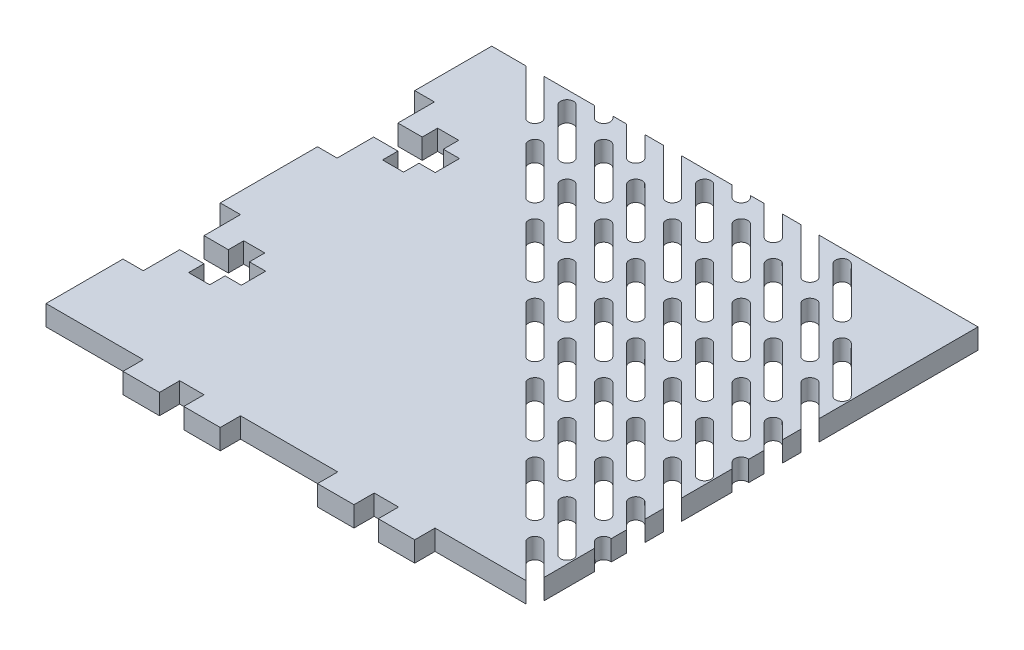
from build123d import *

# Parameters (mm, degrees)
BOSS_EXTRUDE1_DEPTH = 3.175
CUT_EXTRUDE1_DEPTH  = 54.975


with BuildPart() as part:
    # Sketch1 → Boss-Extrude1 (new body)
    with BuildSketch(Plane(origin=(0, 0, 0), x_dir=(1, 0, 0), z_dir=(0, 1, 0))):
        Polygon((-27.813, -13.335), (-25.273, -13.335), (-25.273, -17.145), (-27.813, -17.145), (-27.813, -19.558), (-31.115, -19.558), (-31.115, -17.145), (-34.925, -17.145), (-34.925, -22.86), (-38.1, -22.86), (-38.1, -34.925), (-34.925, -34.925), (-22.86, -34.925), (-22.86, -38.1), (-17.145, -38.1), (-17.145, -34.925), (-13.335, -34.925), (-13.335, -38.1), (-7.62, -38.1), (-7.62, -34.925), (7.62, -34.925), (7.62, -38.1), (13.335, -38.1), (13.335, -34.925), (17.145, -34.925), (17.145, -38.1), (22.86, -38.1), (22.86, -34.925), (34.925, -34.925), (38.1, -34.925), (38.1, -22.86), (38.1, 34.925), (34.925, 34.925), (22.86, 34.925), (-34.925, 34.925), (-38.1, 34.925), (-38.1, 22.86), (-35.021495431, 22.86), (-35.021495431, 17.145), (-31.211495431, 17.145), (-31.211495431, 19.558), (-27.909495431, 19.558), (-27.909495431, 17.145), (-25.369495431, 17.145), (-25.369495431, 13.335), (-27.909495431, 13.335), (-27.909495431, 10.922), (-31.211495431, 10.922), (-31.211495431, 13.335), (-35.021495431, 13.335), (-35.021495431, 7.62), (-38.1, 7.62), (-38.1, -7.62), (-34.925, -7.62), (-34.925, -13.335), (-31.115, -13.335), (-31.115, -10.922), (-27.813, -10.922), align=None)
    extrude(amount=BOSS_EXTRUDE1_DEPTH)

    # Sketch2 → Cut-Extrude1 (cut, through all)
    with BuildSketch(Plane.XZ):
        with BuildLine():
            Line((-32.837932463, -34.993193932), (-25.653727566, -27.808989035))
            ThreePointArc((-25.653727566, -27.808989035), (-24.216886587, -27.808989035), (-24.216886587, -29.245830015))
            Line((-24.216886587, -29.245830015), (-31.401091484, -36.430034912))
            ThreePointArc((-31.401091484, -36.430034912), (-32.837932463, -36.430034912), (-32.837932463, -34.993193932))
        make_face()
        with BuildLine():
            Line((-24.935307077, -32.119511973), (-17.75110218, -24.935307077))
            ThreePointArc((-17.75110218, -24.935307077), (-16.3142612, -24.935307077), (-16.3142612, -26.372148056))
            Line((-16.3142612, -26.372148056), (-23.498466097, -33.556352953))
            ThreePointArc((-23.498466097, -33.556352953), (-24.935307077, -33.556352953), (-24.935307077, -32.119511973))
        make_face()
        with BuildLine():
            Line((-22.061625118, -24.216886587), (-14.877420221, -17.03268169))
            ThreePointArc((-14.877420221, -17.03268169), (-13.440579242, -17.03268169), (-13.440579242, -18.469522669))
            Line((-13.440579242, -18.469522669), (-20.624784138, -25.653727566))
            ThreePointArc((-20.624784138, -25.653727566), (-22.061625118, -25.653727566), (-22.061625118, -24.216886587))
        make_face()
        with BuildLine():
            Line((-14.158999731, -21.343204628), (-6.974794834, -14.158999731))
            ThreePointArc((-6.974794834, -14.158999731), (-5.537953855, -14.158999731), (-5.537953855, -15.595840711))
            Line((-5.537953855, -15.595840711), (-12.722158752, -22.780045608))
            ThreePointArc((-12.722158752, -22.780045608), (-14.158999731, -22.780045608), (-14.158999731, -21.343204628))
        make_face()
        with BuildLine():
            Line((-11.285317773, -13.440579242), (-4.101112876, -6.256374345))
            ThreePointArc((-4.101112876, -6.256374345), (-2.664271896, -6.256374345), (-2.664271896, -7.693215324))
            Line((-2.664271896, -7.693215324), (-9.848476793, -14.877420221))
            ThreePointArc((-9.848476793, -14.877420221), (-11.285317773, -14.877420221), (-11.285317773, -13.440579242))
        make_face()
        with BuildLine():
            Line((-3.382692386, -10.566897283), (3.801512511, -3.382692386))
            ThreePointArc((3.801512511, -3.382692386), (5.23835349, -3.382692386), (5.23835349, -4.819533365))
            Line((5.23835349, -4.819533365), (-1.945851407, -12.003738262))
            ThreePointArc((-1.945851407, -12.003738262), (-3.382692386, -12.003738262), (-3.382692386, -10.566897283))
        make_face()
        with BuildLine():
            Line((-0.509010427, -2.664271896), (6.67519447, 4.519933001))
            ThreePointArc((6.67519447, 4.519933001), (8.112035449, 4.519933001), (8.112035449, 3.083092021))
            Line((8.112035449, 3.083092021), (0.927830552, -4.101112876))
            ThreePointArc((0.927830552, -4.101112876), (-0.509010427, -4.101112876), (-0.509010427, -2.664271896))
        make_face()
        with BuildLine():
            Line((7.393614959, 0.209410062), (14.577819856, 7.393614959))
            ThreePointArc((14.577819856, 7.393614959), (16.014660835, 7.393614959), (16.014660835, 5.95677398))
            Line((16.014660835, 5.95677398), (8.830455939, -1.227430917))
            ThreePointArc((8.830455939, -1.227430917), (7.393614959, -1.227430917), (7.393614959, 0.209410062))
        make_face()
        with BuildLine():
            Line((10.267296918, 8.112035449), (17.451501815, 15.296240346))
            ThreePointArc((17.451501815, 15.296240346), (18.888342794, 15.296240346), (18.888342794, 13.859399366))
            Line((18.888342794, 13.859399366), (11.704137897, 6.67519447))
            ThreePointArc((11.704137897, 6.67519447), (10.267296918, 6.67519447), (10.267296918, 8.112035449))
        make_face()
        with BuildLine():
            Line((18.169922305, 10.985717408), (25.354127201, 18.169922305))
            ThreePointArc((25.354127201, 18.169922305), (26.790968181, 18.169922305), (26.790968181, 16.733081325))
            Line((26.790968181, 16.733081325), (19.606763284, 9.548876428))
            ThreePointArc((19.606763284, 9.548876428), (18.169922305, 9.548876428), (18.169922305, 10.985717408))
        make_face()
        with BuildLine():
            Line((21.043604263, 18.888342794), (28.22780916, 26.072547691))
            ThreePointArc((28.22780916, 26.072547691), (29.66465014, 26.072547691), (29.66465014, 24.635706712))
            Line((29.66465014, 24.635706712), (22.480445243, 17.451501815))
            ThreePointArc((22.480445243, 17.451501815), (21.043604263, 17.451501815), (21.043604263, 18.888342794))
        make_face()
        with BuildLine():
            Line((28.94622965, 21.762024753), (36.130434547, 28.94622965))
            ThreePointArc((36.130434547, 28.94622965), (37.567275526, 28.94622965), (37.567275526, 27.50938867))
            Line((37.567275526, 27.50938867), (30.383070629, 20.325183774))
            ThreePointArc((30.383070629, 20.325183774), (28.94622965, 20.325183774), (28.94622965, 21.762024753))
        make_face()
        with BuildLine():
            Line((-16.673471445, -29.60504026), (-9.489266548, -22.420835363))
            ThreePointArc((-9.489266548, -22.420835363), (-8.052425569, -22.420835363), (-8.052425569, -23.857676342))
            Line((-8.052425569, -23.857676342), (-15.236630466, -31.041881239))
            ThreePointArc((-15.236630466, -31.041881239), (-16.673471445, -31.041881239), (-16.673471445, -29.60504026))
        make_face()
        with BuildLine():
            Line((-8.770846059, -26.731358301), (-1.586641162, -19.547153404))
            ThreePointArc((-1.586641162, -19.547153404), (-0.149800182, -19.547153404), (-0.149800182, -20.983994383))
            Line((-0.149800182, -20.983994383), (-7.334005079, -28.16819928))
            ThreePointArc((-7.334005079, -28.16819928), (-8.770846059, -28.16819928), (-8.770846059, -26.731358301))
        make_face()
        with BuildLine():
            Line((-5.8971641, -18.828732914), (1.287040797, -11.644528017))
            ThreePointArc((1.287040797, -11.644528017), (2.723881776, -11.644528017), (2.723881776, -13.081368997))
            Line((2.723881776, -13.081368997), (-4.460323121, -20.265573894))
            ThreePointArc((-4.460323121, -20.265573894), (-5.8971641, -20.265573894), (-5.8971641, -18.828732914))
        make_face()
        with BuildLine():
            Line((2.005461287, -15.955050956), (9.189666183, -8.770846059))
            ThreePointArc((9.189666183, -8.770846059), (10.626507163, -8.770846059), (10.626507163, -10.207687038))
            Line((10.626507163, -10.207687038), (3.442302266, -17.391891935))
            ThreePointArc((3.442302266, -17.391891935), (2.005461287, -17.391891935), (2.005461287, -15.955050956))
        make_face()
        with BuildLine():
            Line((4.879143245, -8.052425569), (12.063348142, -0.868220672))
            ThreePointArc((12.063348142, -0.868220672), (13.500189122, -0.868220672), (13.500189122, -2.305061651))
            Line((13.500189122, -2.305061651), (6.315984225, -9.489266548))
            ThreePointArc((6.315984225, -9.489266548), (4.879143245, -9.489266548), (4.879143245, -8.052425569))
        make_face()
        with BuildLine():
            Line((12.781768632, -5.17874361), (19.965973529, 2.005461287))
            ThreePointArc((19.965973529, 2.005461287), (21.402814508, 2.005461287), (21.402814508, 0.568620307))
            Line((21.402814508, 0.568620307), (14.218609611, -6.61558459))
            ThreePointArc((14.218609611, -6.61558459), (12.781768632, -6.61558459), (12.781768632, -5.17874361))
        make_face()
        with BuildLine():
            Line((15.655450591, 2.723881776), (22.839655488, 9.908086673))
            ThreePointArc((22.839655488, 9.908086673), (24.276496467, 9.908086673), (24.276496467, 8.471245694))
            Line((24.276496467, 8.471245694), (17.09229157, 1.287040797))
            ThreePointArc((17.09229157, 1.287040797), (15.655450591, 1.287040797), (15.655450591, 2.723881776))
        make_face()
        with BuildLine():
            Line((23.558075977, 5.597563735), (30.742280874, 12.781768632))
            ThreePointArc((30.742280874, 12.781768632), (32.179121853, 12.781768632), (32.179121853, 11.344927653))
            Line((32.179121853, 11.344927653), (24.994916957, 4.160722756))
            ThreePointArc((24.994916957, 4.160722756), (23.558075977, 4.160722756), (23.558075977, 5.597563735))
        make_face()
        with BuildLine():
            Line((26.431757936, 13.500189122), (33.615962833, 20.684394018))
            ThreePointArc((33.615962833, 20.684394018), (35.052803812, 20.684394018), (35.052803812, 19.247553039))
            Line((35.052803812, 19.247553039), (27.868598915, 12.063348142))
            ThreePointArc((27.868598915, 12.063348142), (26.431757936, 12.063348142), (26.431757936, 13.500189122))
        make_face()
        with BuildLine():
            Line((34.334383322, 16.37387108), (41.518588219, 23.558075977))
            ThreePointArc((41.518588219, 23.558075977), (42.955429199, 23.558075977), (42.955429199, 22.121234998))
            Line((42.955429199, 22.121234998), (35.771224302, 14.937030101))
            ThreePointArc((35.771224302, 14.937030101), (34.334383322, 14.937030101), (34.334383322, 16.37387108))
        make_face()
        with BuildLine():
            Line((-11.285317773, -34.993193932), (-4.101112876, -27.808989035))
            ThreePointArc((-4.101112876, -27.808989035), (-2.664271896, -27.808989035), (-2.664271896, -29.245830015))
            Line((-2.664271896, -29.245830015), (-9.848476793, -36.430034912))
            ThreePointArc((-9.848476793, -36.430034912), (-11.285317773, -36.430034912), (-11.285317773, -34.993193932))
        make_face()
        with BuildLine():
            Line((-3.382692386, -32.119511973), (3.801512511, -24.935307077))
            ThreePointArc((3.801512511, -24.935307077), (5.23835349, -24.935307077), (5.23835349, -26.372148056))
            Line((5.23835349, -26.372148056), (-1.945851407, -33.556352953))
            ThreePointArc((-1.945851407, -33.556352953), (-3.382692386, -33.556352953), (-3.382692386, -32.119511973))
        make_face()
        with BuildLine():
            Line((-0.509010427, -24.216886587), (6.67519447, -17.03268169))
            ThreePointArc((6.67519447, -17.03268169), (8.112035449, -17.03268169), (8.112035449, -18.469522669))
            Line((8.112035449, -18.469522669), (0.927830552, -25.653727566))
            ThreePointArc((0.927830552, -25.653727566), (-0.509010427, -25.653727566), (-0.509010427, -24.216886587))
        make_face()
        with BuildLine():
            Line((7.393614959, -21.343204628), (14.577819856, -14.158999731))
            ThreePointArc((14.577819856, -14.158999731), (16.014660835, -14.158999731), (16.014660835, -15.595840711))
            Line((16.014660835, -15.595840711), (8.830455939, -22.780045608))
            ThreePointArc((8.830455939, -22.780045608), (7.393614959, -22.780045608), (7.393614959, -21.343204628))
        make_face()
        with BuildLine():
            Line((10.267296918, -13.440579242), (17.451501815, -6.256374345))
            ThreePointArc((17.451501815, -6.256374345), (18.888342794, -6.256374345), (18.888342794, -7.693215324))
            Line((18.888342794, -7.693215324), (11.704137897, -14.877420221))
            ThreePointArc((11.704137897, -14.877420221), (10.267296918, -14.877420221), (10.267296918, -13.440579242))
        make_face()
        with BuildLine():
            Line((18.169922305, -10.566897283), (25.354127201, -3.382692386))
            ThreePointArc((25.354127201, -3.382692386), (26.790968181, -3.382692386), (26.790968181, -4.819533365))
            Line((26.790968181, -4.819533365), (19.606763284, -12.003738262))
            ThreePointArc((19.606763284, -12.003738262), (18.169922305, -12.003738262), (18.169922305, -10.566897283))
        make_face()
        with BuildLine():
            Line((21.043604263, -2.664271896), (28.22780916, 4.519933001))
            ThreePointArc((28.22780916, 4.519933001), (29.66465014, 4.519933001), (29.66465014, 3.083092021))
            Line((29.66465014, 3.083092021), (22.480445243, -4.101112876))
            ThreePointArc((22.480445243, -4.101112876), (21.043604263, -4.101112876), (21.043604263, -2.664271896))
        make_face()
        with BuildLine():
            Line((28.94622965, 0.209410062), (36.130434547, 7.393614959))
            ThreePointArc((36.130434547, 7.393614959), (37.567275526, 7.393614959), (37.567275526, 5.95677398))
            Line((37.567275526, 5.95677398), (30.383070629, -1.227430917))
            ThreePointArc((30.383070629, -1.227430917), (28.94622965, -1.227430917), (28.94622965, 0.209410062))
        make_face()
        with BuildLine():
            Line((31.819911609, 8.112035449), (39.004116505, 15.296240346))
            ThreePointArc((39.004116505, 15.296240346), (40.440957485, 15.296240346), (40.440957485, 13.859399366))
            Line((40.440957485, 13.859399366), (33.256752588, 6.67519447))
            ThreePointArc((33.256752588, 6.67519447), (31.819911609, 6.67519447), (31.819911609, 8.112035449))
        make_face()
        with BuildLine():
            Line((39.722536995, 10.985717408), (46.906741892, 18.169922305))
            ThreePointArc((46.906741892, 18.169922305), (48.343582871, 18.169922305), (48.343582871, 16.733081325))
            Line((48.343582871, 16.733081325), (41.159377974, 9.548876428))
            ThreePointArc((41.159377974, 9.548876428), (39.722536995, 9.548876428), (39.722536995, 10.985717408))
        make_face()
        with BuildLine():
            Line((-5.8971641, -40.381347605), (1.287040797, -33.197142708))
            ThreePointArc((1.287040797, -33.197142708), (2.723881776, -33.197142708), (2.723881776, -34.633983687))
            Line((2.723881776, -34.633983687), (-4.460323121, -41.818188584))
            ThreePointArc((-4.460323121, -41.818188584), (-5.8971641, -41.818188584), (-5.8971641, -40.381347605))
        make_face()
        with BuildLine():
            Line((2.005461287, -37.507665646), (9.189666183, -30.323460749))
            ThreePointArc((9.189666183, -30.323460749), (10.626507163, -30.323460749), (10.626507163, -31.760301729))
            Line((10.626507163, -31.760301729), (3.442302266, -38.944506625))
            ThreePointArc((3.442302266, -38.944506625), (2.005461287, -38.944506625), (2.005461287, -37.507665646))
        make_face()
        with BuildLine():
            Line((4.879143245, -29.60504026), (12.063348142, -22.420835363))
            ThreePointArc((12.063348142, -22.420835363), (13.500189122, -22.420835363), (13.500189122, -23.857676342))
            Line((13.500189122, -23.857676342), (6.315984225, -31.041881239))
            ThreePointArc((6.315984225, -31.041881239), (4.879143245, -31.041881239), (4.879143245, -29.60504026))
        make_face()
        with BuildLine():
            Line((12.781768632, -26.731358301), (19.965973529, -19.547153404))
            ThreePointArc((19.965973529, -19.547153404), (21.402814508, -19.547153404), (21.402814508, -20.983994383))
            Line((21.402814508, -20.983994383), (14.218609611, -28.16819928))
            ThreePointArc((14.218609611, -28.16819928), (12.781768632, -28.16819928), (12.781768632, -26.731358301))
        make_face()
        with BuildLine():
            Line((15.655450591, -18.828732914), (22.839655488, -11.644528017))
            ThreePointArc((22.839655488, -11.644528017), (24.276496467, -11.644528017), (24.276496467, -13.081368997))
            Line((24.276496467, -13.081368997), (17.09229157, -20.265573894))
            ThreePointArc((17.09229157, -20.265573894), (15.655450591, -20.265573894), (15.655450591, -18.828732914))
        make_face()
        with BuildLine():
            Line((23.558075977, -15.955050956), (30.742280874, -8.770846059))
            ThreePointArc((30.742280874, -8.770846059), (32.179121853, -8.770846059), (32.179121853, -10.207687038))
            Line((32.179121853, -10.207687038), (24.994916957, -17.391891935))
            ThreePointArc((24.994916957, -17.391891935), (23.558075977, -17.391891935), (23.558075977, -15.955050956))
        make_face()
        with BuildLine():
            Line((26.431757936, -8.052425569), (33.615962833, -0.868220672))
            ThreePointArc((33.615962833, -0.868220672), (35.052803812, -0.868220672), (35.052803812, -2.305061651))
            Line((35.052803812, -2.305061651), (27.868598915, -9.489266548))
            ThreePointArc((27.868598915, -9.489266548), (26.431757936, -9.489266548), (26.431757936, -8.052425569))
        make_face()
        with BuildLine():
            Line((34.334383322, -5.17874361), (41.518588219, 2.005461287))
            ThreePointArc((41.518588219, 2.005461287), (42.955429199, 2.005461287), (42.955429199, 0.568620307))
            Line((42.955429199, 0.568620307), (35.771224302, -6.61558459))
            ThreePointArc((35.771224302, -6.61558459), (34.334383322, -6.61558459), (34.334383322, -5.17874361))
        make_face()
        with BuildLine():
            Line((37.208065281, 2.723881776), (44.392270178, 9.908086673))
            ThreePointArc((44.392270178, 9.908086673), (45.829111157, 9.908086673), (45.829111157, 8.471245694))
            Line((45.829111157, 8.471245694), (38.644906261, 1.287040797))
            ThreePointArc((38.644906261, 1.287040797), (37.208065281, 1.287040797), (37.208065281, 2.723881776))
        make_face()
        with BuildLine():
            Line((45.110690668, 5.597563735), (52.294895565, 12.781768632))
            ThreePointArc((52.294895565, 12.781768632), (53.731736544, 12.781768632), (53.731736544, 11.344927653))
            Line((53.731736544, 11.344927653), (46.547531647, 4.160722756))
            ThreePointArc((46.547531647, 4.160722756), (45.110690668, 4.160722756), (45.110690668, 5.597563735))
        make_face()
        with BuildLine():
            Line((-0.509010427, -45.769501277), (6.67519447, -38.585296381))
            ThreePointArc((6.67519447, -38.585296381), (8.112035449, -38.585296381), (8.112035449, -40.02213736))
            Line((8.112035449, -40.02213736), (0.927830552, -47.206342257))
            ThreePointArc((0.927830552, -47.206342257), (-0.509010427, -47.206342257), (-0.509010427, -45.769501277))
        make_face()
        with BuildLine():
            Line((7.393614959, -42.895819319), (14.577819856, -35.711614422))
            ThreePointArc((14.577819856, -35.711614422), (16.014660835, -35.711614422), (16.014660835, -37.148455401))
            Line((16.014660835, -37.148455401), (8.830455939, -44.332660298))
            ThreePointArc((8.830455939, -44.332660298), (7.393614959, -44.332660298), (7.393614959, -42.895819319))
        make_face()
        with BuildLine():
            Line((10.267296918, -34.993193932), (17.451501815, -27.808989035))
            ThreePointArc((17.451501815, -27.808989035), (18.888342794, -27.808989035), (18.888342794, -29.245830015))
            Line((18.888342794, -29.245830015), (11.704137897, -36.430034912))
            ThreePointArc((11.704137897, -36.430034912), (10.267296918, -36.430034912), (10.267296918, -34.993193932))
        make_face()
        with BuildLine():
            Line((18.169922305, -32.119511973), (25.354127201, -24.935307077))
            ThreePointArc((25.354127201, -24.935307077), (26.790968181, -24.935307077), (26.790968181, -26.372148056))
            Line((26.790968181, -26.372148056), (19.606763284, -33.556352953))
            ThreePointArc((19.606763284, -33.556352953), (18.169922305, -33.556352953), (18.169922305, -32.119511973))
        make_face()
        with BuildLine():
            Line((21.043604263, -24.216886587), (28.22780916, -17.03268169))
            ThreePointArc((28.22780916, -17.03268169), (29.66465014, -17.03268169), (29.66465014, -18.469522669))
            Line((29.66465014, -18.469522669), (22.480445243, -25.653727566))
            ThreePointArc((22.480445243, -25.653727566), (21.043604263, -25.653727566), (21.043604263, -24.216886587))
        make_face()
        with BuildLine():
            Line((28.94622965, -21.343204628), (36.130434547, -14.158999731))
            ThreePointArc((36.130434547, -14.158999731), (37.567275526, -14.158999731), (37.567275526, -15.595840711))
            Line((37.567275526, -15.595840711), (30.383070629, -22.780045608))
            ThreePointArc((30.383070629, -22.780045608), (28.94622965, -22.780045608), (28.94622965, -21.343204628))
        make_face()
        with BuildLine():
            Line((31.819911609, -13.440579242), (39.004116505, -6.256374345))
            ThreePointArc((39.004116505, -6.256374345), (40.440957485, -6.256374345), (40.440957485, -7.693215324))
            Line((40.440957485, -7.693215324), (33.256752588, -14.877420221))
            ThreePointArc((33.256752588, -14.877420221), (31.819911609, -14.877420221), (31.819911609, -13.440579242))
        make_face()
        with BuildLine():
            Line((39.722536995, -10.566897283), (46.906741892, -3.382692386))
            ThreePointArc((46.906741892, -3.382692386), (48.343582871, -3.382692386), (48.343582871, -4.819533365))
            Line((48.343582871, -4.819533365), (41.159377974, -12.003738262))
            ThreePointArc((41.159377974, -12.003738262), (39.722536995, -12.003738262), (39.722536995, -10.566897283))
        make_face()
        with BuildLine():
            Line((42.596218954, -2.664271896), (49.780423851, 4.519933001))
            ThreePointArc((49.780423851, 4.519933001), (51.21726483, 4.519933001), (51.21726483, 3.083092021))
            Line((51.21726483, 3.083092021), (44.033059933, -4.101112876))
            ThreePointArc((44.033059933, -4.101112876), (42.596218954, -4.101112876), (42.596218954, -2.664271896))
        make_face()
        with BuildLine():
            Line((50.49884434, 0.209410062), (57.683049237, 7.393614959))
            ThreePointArc((57.683049237, 7.393614959), (59.119890217, 7.393614959), (59.119890217, 5.95677398))
            Line((59.119890217, 5.95677398), (51.93568532, -1.227430917))
            ThreePointArc((51.93568532, -1.227430917), (50.49884434, -1.227430917), (50.49884434, 0.209410062))
        make_face()
        with BuildLine():
            Line((-27.44977879, -40.381347605), (-20.265573894, -33.197142708))
            ThreePointArc((-20.265573894, -33.197142708), (-18.828732914, -33.197142708), (-18.828732914, -34.633983687))
            Line((-18.828732914, -34.633983687), (-26.012937811, -41.818188584))
            ThreePointArc((-26.012937811, -41.818188584), (-27.44977879, -41.818188584), (-27.44977879, -40.381347605))
        make_face()
        with BuildLine():
            Line((-19.547153404, -37.507665646), (-12.362948507, -30.323460749))
            ThreePointArc((-12.362948507, -30.323460749), (-10.926107528, -30.323460749), (-10.926107528, -31.760301729))
            Line((-10.926107528, -31.760301729), (-18.110312425, -38.944506625))
            ThreePointArc((-18.110312425, -38.944506625), (-19.547153404, -38.944506625), (-19.547153404, -37.507665646))
        make_face()
        with BuildLine():
            Line((-22.061625118, -45.769501277), (-14.877420221, -38.585296381))
            ThreePointArc((-14.877420221, -38.585296381), (-13.440579242, -38.585296381), (-13.440579242, -40.02213736))
            Line((-13.440579242, -40.02213736), (-20.624784138, -47.206342257))
            ThreePointArc((-20.624784138, -47.206342257), (-22.061625118, -47.206342257), (-22.061625118, -45.769501277))
        make_face()
        with BuildLine():
            Line((-14.158999731, -42.895819319), (-6.974794834, -35.711614422))
            ThreePointArc((-6.974794834, -35.711614422), (-5.537953855, -35.711614422), (-5.537953855, -37.148455401))
            Line((-5.537953855, -37.148455401), (-12.722158752, -44.332660298))
            ThreePointArc((-12.722158752, -44.332660298), (-14.158999731, -44.332660298), (-14.158999731, -42.895819319))
        make_face()
        with BuildLine():
            Line((-16.673471445, -51.15765495), (-9.489266548, -43.973450053))
            ThreePointArc((-9.489266548, -43.973450053), (-8.052425569, -43.973450053), (-8.052425569, -45.410291033))
            Line((-8.052425569, -45.410291033), (-15.236630466, -52.594495929))
            ThreePointArc((-15.236630466, -52.594495929), (-16.673471445, -52.594495929), (-16.673471445, -51.15765495))
        make_face()
        with BuildLine():
            Line((-8.770846059, -48.283972991), (-1.586641162, -41.099768095))
            ThreePointArc((-1.586641162, -41.099768095), (-0.149800182, -41.099768095), (-0.149800182, -42.536609074))
            Line((-0.149800182, -42.536609074), (-7.334005079, -49.720813971))
            ThreePointArc((-7.334005079, -49.720813971), (-8.770846059, -49.720813971), (-8.770846059, -48.283972991))
        make_face()
        with BuildLine():
            Line((-11.285317773, -56.545808623), (-4.101112876, -49.361603726))
            ThreePointArc((-4.101112876, -49.361603726), (-2.664271896, -49.361603726), (-2.664271896, -50.798444705))
            Line((-2.664271896, -50.798444705), (-9.848476793, -57.982649602))
            ThreePointArc((-9.848476793, -57.982649602), (-11.285317773, -57.982649602), (-11.285317773, -56.545808623))
        make_face()
        with BuildLine():
            Line((-3.382692386, -53.672126664), (3.801512511, -46.487921767))
            ThreePointArc((3.801512511, -46.487921767), (5.23835349, -46.487921767), (5.23835349, -47.924762747))
            Line((5.23835349, -47.924762747), (-1.945851407, -55.108967643))
            ThreePointArc((-1.945851407, -55.108967643), (-3.382692386, -55.108967643), (-3.382692386, -53.672126664))
        make_face()
        with BuildLine():
            Line((31.819911609, 29.66465014), (39.004116505, 36.848855036))
            ThreePointArc((39.004116505, 36.848855036), (40.440957485, 36.848855036), (40.440957485, 35.412014057))
            Line((40.440957485, 35.412014057), (33.256752588, 28.22780916))
            ThreePointArc((33.256752588, 28.22780916), (31.819911609, 28.22780916), (31.819911609, 29.66465014))
        make_face()
        with BuildLine():
            Line((39.722536995, 32.538332098), (46.906741892, 39.722536995))
            ThreePointArc((46.906741892, 39.722536995), (48.343582871, 39.722536995), (48.343582871, 38.285696016))
            Line((48.343582871, 38.285696016), (41.159377974, 31.101491119))
            ThreePointArc((41.159377974, 31.101491119), (39.722536995, 31.101491119), (39.722536995, 32.538332098))
        make_face()
        with BuildLine():
            Line((37.208065281, 24.276496467), (44.392270178, 31.460701364))
            ThreePointArc((44.392270178, 31.460701364), (45.829111157, 31.460701364), (45.829111157, 30.023860384))
            Line((45.829111157, 30.023860384), (38.644906261, 22.839655488))
            ThreePointArc((38.644906261, 22.839655488), (37.208065281, 22.839655488), (37.208065281, 24.276496467))
        make_face()
        with BuildLine():
            Line((45.110690668, 27.150178426), (52.294895565, 34.334383322))
            ThreePointArc((52.294895565, 34.334383322), (53.731736544, 34.334383322), (53.731736544, 32.897542343))
            Line((53.731736544, 32.897542343), (46.547531647, 25.713337446))
            ThreePointArc((46.547531647, 25.713337446), (45.110690668, 25.713337446), (45.110690668, 27.150178426))
        make_face()
        with BuildLine():
            Line((42.596218954, 18.888342794), (49.780423851, 26.072547691))
            ThreePointArc((49.780423851, 26.072547691), (51.21726483, 26.072547691), (51.21726483, 24.635706712))
            Line((51.21726483, 24.635706712), (44.033059933, 17.451501815))
            ThreePointArc((44.033059933, 17.451501815), (42.596218954, 17.451501815), (42.596218954, 18.888342794))
        make_face()
        with BuildLine():
            Line((50.49884434, 21.762024753), (57.683049237, 28.94622965))
            ThreePointArc((57.683049237, 28.94622965), (59.119890217, 28.94622965), (59.119890217, 27.50938867))
            Line((59.119890217, 27.50938867), (51.93568532, 20.325183774))
            ThreePointArc((51.93568532, 20.325183774), (50.49884434, 20.325183774), (50.49884434, 21.762024753))
        make_face()
        with BuildLine():
            Line((47.984372627, 13.500189122), (55.168577523, 20.684394018))
            ThreePointArc((55.168577523, 20.684394018), (56.605418503, 20.684394018), (56.605418503, 19.247553039))
            Line((56.605418503, 19.247553039), (49.421213606, 12.063348142))
            ThreePointArc((49.421213606, 12.063348142), (47.984372627, 12.063348142), (47.984372627, 13.500189122))
        make_face()
        with BuildLine():
            Line((55.886998013, 16.37387108), (63.07120291, 23.558075977))
            ThreePointArc((63.07120291, 23.558075977), (64.508043889, 23.558075977), (64.508043889, 22.121234998))
            Line((64.508043889, 22.121234998), (57.323838992, 14.937030101))
            ThreePointArc((57.323838992, 14.937030101), (55.886998013, 14.937030101), (55.886998013, 16.37387108))
        make_face()
        with BuildLine():
            Line((53.372526299, 8.112035449), (60.556731196, 15.296240346))
            ThreePointArc((60.556731196, 15.296240346), (61.993572175, 15.296240346), (61.993572175, 13.859399366))
            Line((61.993572175, 13.859399366), (54.809367279, 6.67519447))
            ThreePointArc((54.809367279, 6.67519447), (53.372526299, 6.67519447), (53.372526299, 8.112035449))
        make_face()
        with BuildLine():
            Line((61.275151686, 10.985717408), (68.459356583, 18.169922305))
            ThreePointArc((68.459356583, 18.169922305), (69.896197562, 18.169922305), (69.896197562, 16.733081325))
            Line((69.896197562, 16.733081325), (62.711992665, 9.548876428))
            ThreePointArc((62.711992665, 9.548876428), (61.275151686, 9.548876428), (61.275151686, 10.985717408))
        make_face()
    extrude(amount=-CUT_EXTRUDE1_DEPTH, mode=Mode.SUBTRACT)


solid = part.part
